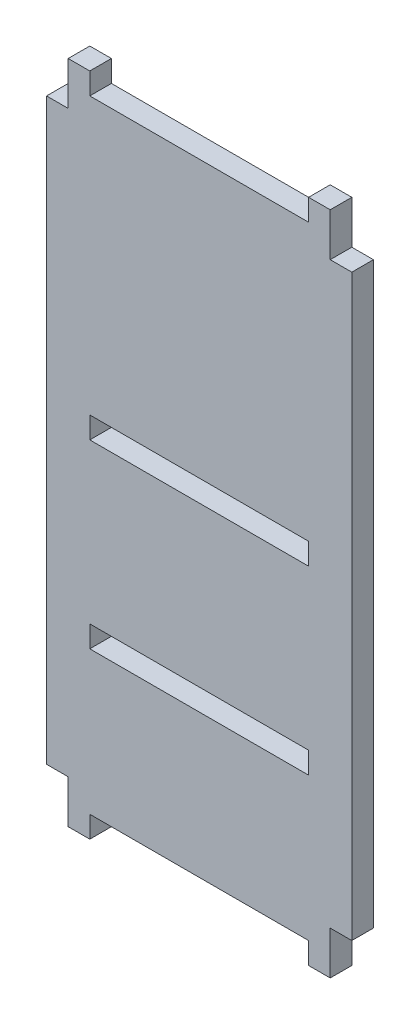
from build123d import *

# Parameters (mm, degrees)
SKETCH1_W           = 64.2874
SKETCH1_H           = 6.35
BOSS_EXTRUDE1_DEPTH = 6.35


with BuildPart() as part:
    # Sketch1 → Boss-Extrude1 (new body)
    with BuildSketch(Plane.XY):
        Polygon((-41.8719, 0), (-41.8719, 12.7), (-48.2219, 12.7), (-48.2219, 182.772742275), (-41.8719, 182.772742275), (-41.8719, 195.472742275), (-35.5219, 195.472742275), (-35.5219, 189.122742275), (28.7655, 189.122742275), (28.7655, 195.472742275), (35.1155, 195.472742275), (35.1155, 182.772742275), (41.4655, 182.772742275), (41.4655, 12.7), (35.1155, 12.7), (35.1155, 0), (28.7655, 0), (28.7655, 6.35), (-35.5219, 6.35), (-35.5219, 0), align=None)
        with Locations((-3.3782, 51.6128)):
            Rectangle(SKETCH1_W, SKETCH1_H, mode=Mode.SUBTRACT)
        with Locations((-3.3782, 104.775)):
            Rectangle(SKETCH1_W, SKETCH1_H, mode=Mode.SUBTRACT)
    extrude(amount=BOSS_EXTRUDE1_DEPTH)


solid = part.part
